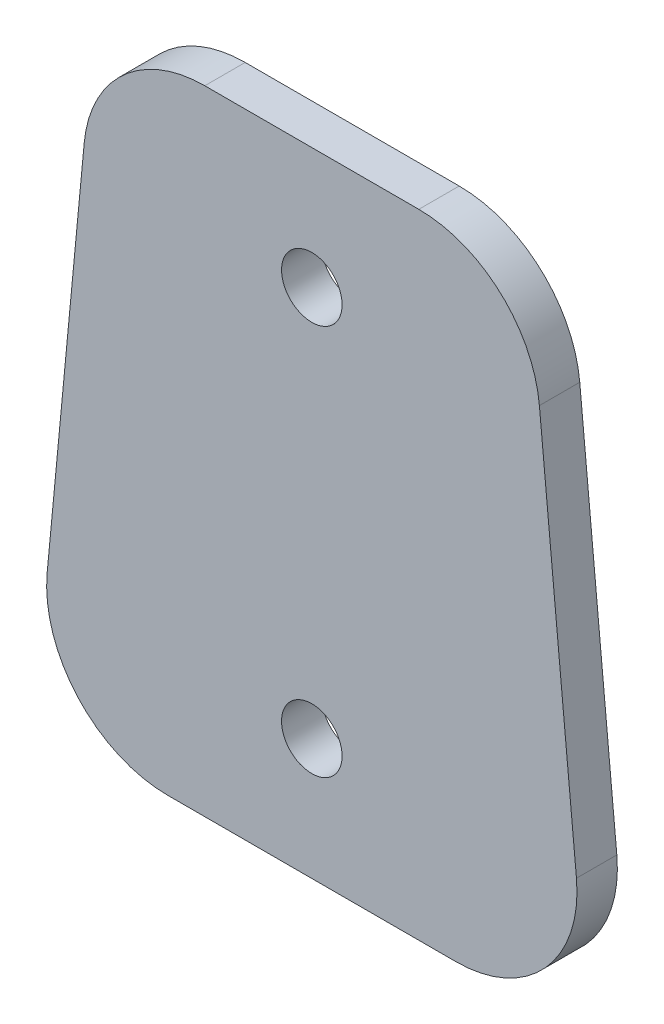
from build123d import *

# Parameters (mm, degrees)
SKETCH2_R           = 2.38125
BOSS_EXTRUDE1_DEPTH = 3.175


with BuildPart() as part:
    # Sketch2 → Boss-Extrude1 (new body)
    with BuildSketch(Plane.XY):
        with BuildLine():
            Line((44.625300106, 31.633198887), (41.710869071, 62.367198887))
            ThreePointArc((41.710869071, 62.367198887), (38.637805701, 68.513938348), (32.228408085, 70.993))
            Line((32.228408085, 70.993), (15.396591915, 70.993))
            ThreePointArc((15.396591915, 70.993), (8.987194299, 68.513938348), (5.914130929, 62.367198887))
            Line((5.914130929, 62.367198887), (2.999699894, 31.633198887))
            ThreePointArc((2.999699894, 31.633198887), (5.436222533, 24.324602384), (12.482160881, 21.209))
            Line((12.482160881, 21.209), (35.142839119, 21.209))
            ThreePointArc((35.142839119, 21.209), (42.188777467, 24.324602384), (44.625300106, 31.633198887))
        make_face()
        with Locations((23.8125, 30.734)):
            Circle(SKETCH2_R, mode=Mode.SUBTRACT)
        with Locations((23.8125, 61.468)):
            Circle(SKETCH2_R, mode=Mode.SUBTRACT)
    extrude(amount=BOSS_EXTRUDE1_DEPTH)


solid = part.part
